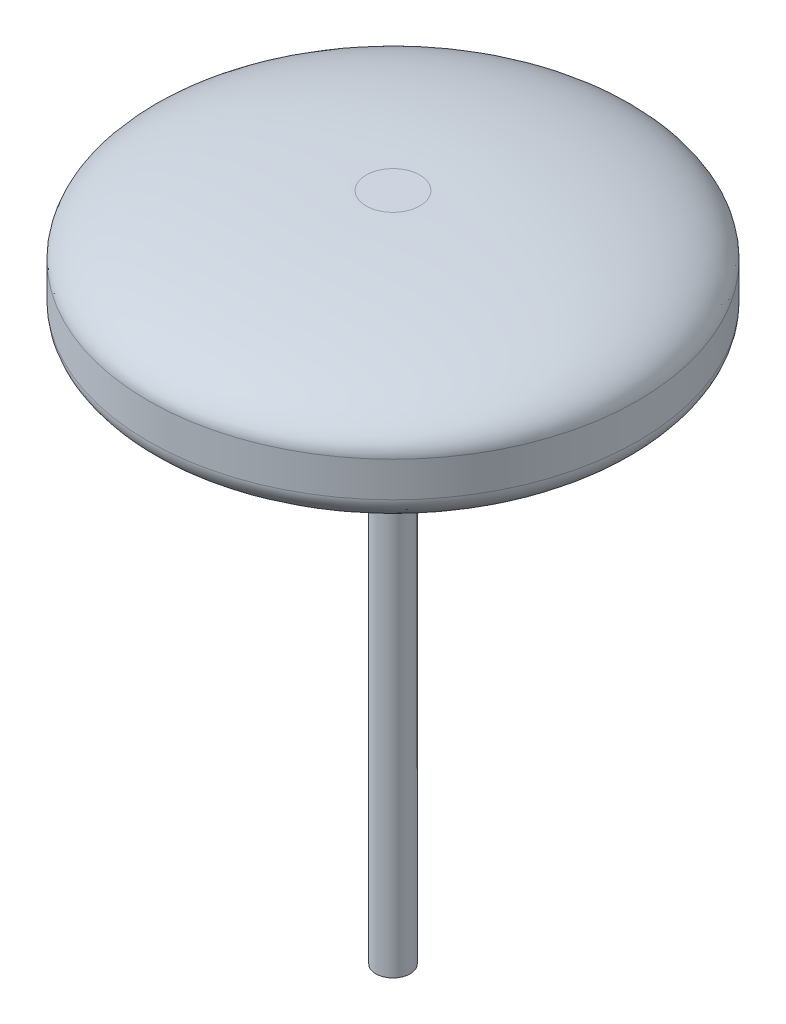
from build123d import *

# Parameters (mm, degrees)
SKETCH8_R           = 2
BOSS_EXTRUDE3_DEPTH = 60


with BuildPart() as part:
    # Sketch7 → Revolve2 (revolve)
    with BuildSketch(Plane.XY, mode=Mode.PRIVATE) as revolve2_sk:
        with BuildLine():
            Line((28.5, -2.04421243), (28.5, 2.04421243))
            add(Edge.make_bspline(
                [(28.5, 2.04421243), (28.5, 5.980056208), (17.452650763, 9), (3.121109552, 9)],
                knots=[0, 0, 0, 0, 1, 1, 1, 1], degree=3))
            Line((3.121109552, 9), (0, 9))
            Line((0, 9), (0, -9))
            Line((0, -9), (3.121109552, -9))
            add(Edge.make_bspline(
                [(28.5, -2.04421243), (28.5, -5.980056208), (17.452650763, -9), (3.121109552, -9)],
                knots=[0, 0, 0, 0, 1, 1, 1, 1], degree=3))
        make_face()
    revolve(revolve2_sk.sketch.rotate(Axis((0, 0, 0), (0, 1, 0)), 90), axis=Axis((0, 0, 0), (0, 1, 0)))

    # Sketch8 → Boss-Extrude3 (add)
    with BuildSketch(Plane.XZ.offset(9)):
        with Locations(Location((0, 0, 0), (0, 0, 270))):
            Circle(SKETCH8_R)
    extrude(amount=BOSS_EXTRUDE3_DEPTH)


solid = part.part
